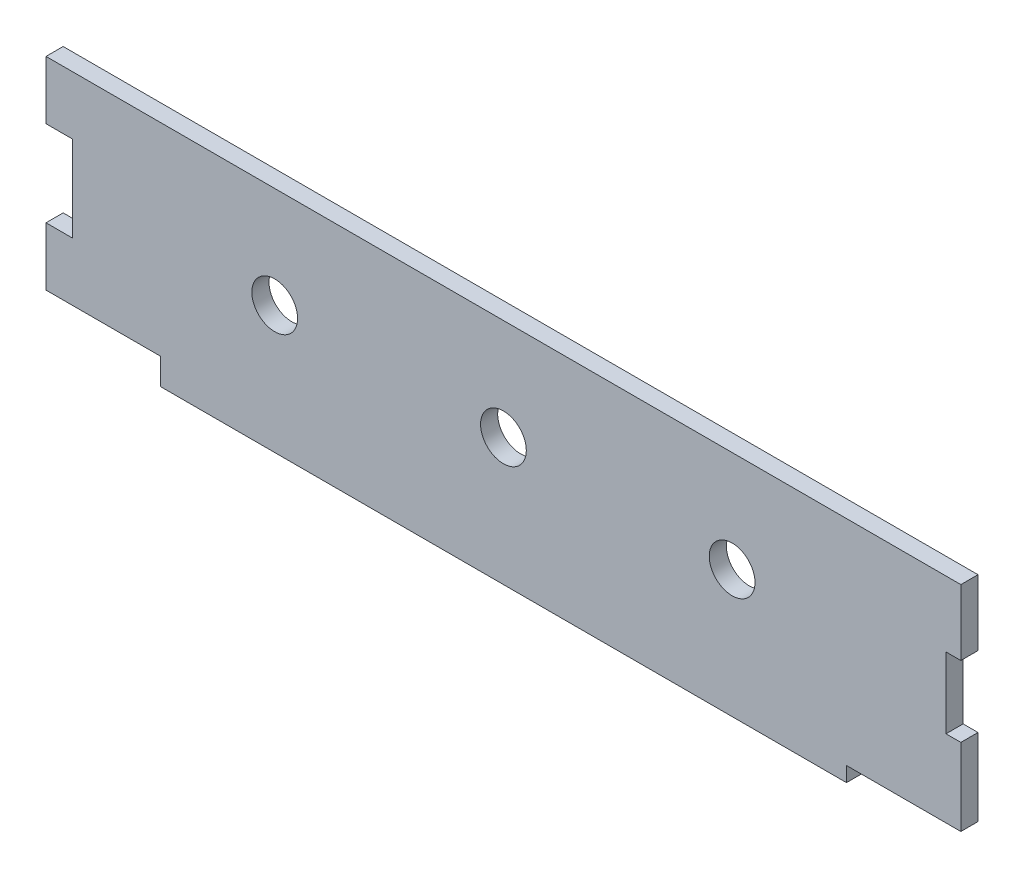
from build123d import *

# Parameters (mm, degrees)
CROQUIS1_R              = 2
SALIENTE_EXTRUIR1_DEPTH = 1.5


with BuildPart() as part:
    # Croquis1 → Saliente-Extruir1 (new body)
    with BuildSketch(Plane.XY):
        Polygon((-40, 8.85), (40, 8.85), (40, 3.1), (38.7, 3.1), (38.7, -3.1), (40, -3.1), (40, -9.85), (30, -9.85), (30, -11.15), (-30, -11.15), (-30, -8.85), (-40, -8.85), (-40, -3.75), (-37.7, -3.75), (-37.7, 3.75), (-40, 3.75), align=None)
        with Locations((20, 0)):
            Circle(CROQUIS1_R, mode=Mode.SUBTRACT)
        Circle(CROQUIS1_R, mode=Mode.SUBTRACT)
        with Locations((-20, 0)):
            Circle(CROQUIS1_R, mode=Mode.SUBTRACT)
    extrude(amount=SALIENTE_EXTRUIR1_DEPTH)


solid = part.part
